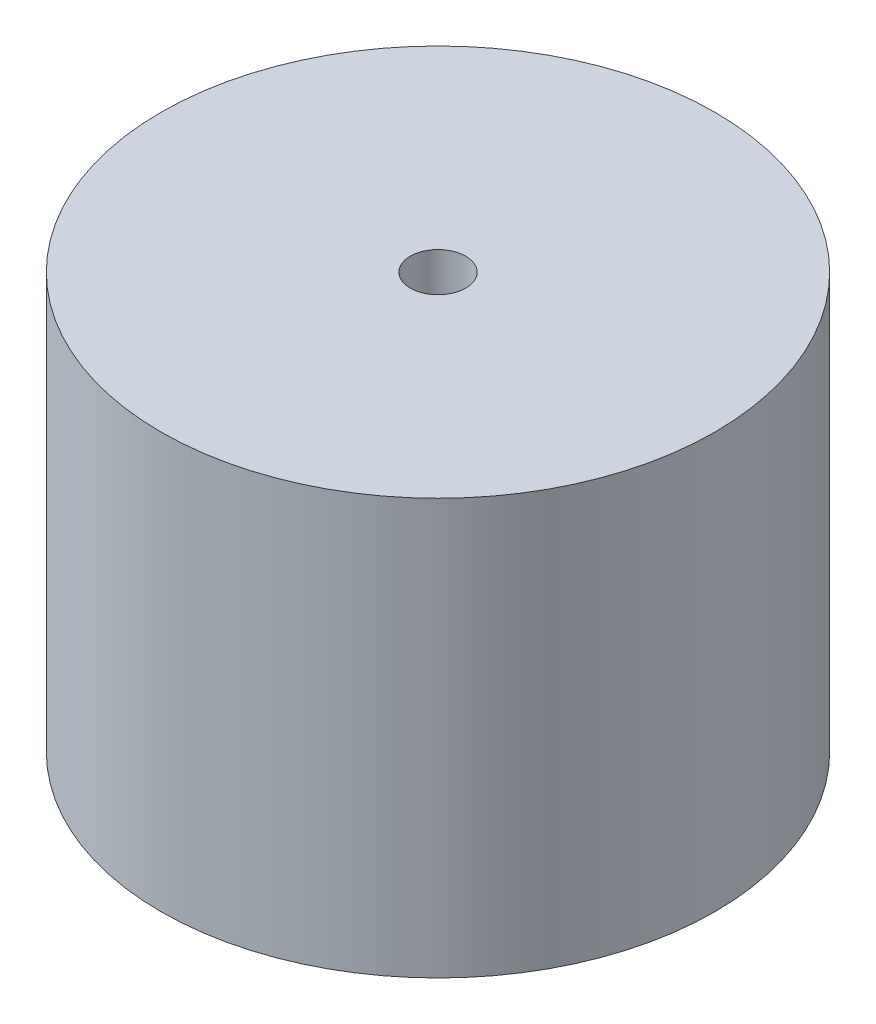
from build123d import *

# Parameters (mm, degrees)
SKETCH_1_R               = 5
EXTRUDE_1_DEPTH          = 7.5
SKETCH_1_5_R             = 2.75
CUT_EXTRUDE_1_DEPTH      = 6.5
SKETCH_1_6_R             = 0.5
CUT_EXTRUDE_2_DEPTH      = 11.307764064
SKETCH_1_7_R             = 0.35
CUT_EXTRUDE_3_DEPTH      = 2
PATTERN_CIRCULAR_1_COUNT = 4


with BuildPart() as part:
    # 草图1 → 凸台-拉伸1 (new body)
    with BuildSketch(Plane(origin=(0, 0, 0), x_dir=(1, 0, 0), z_dir=(0, 1, 0))):
        Circle(SKETCH_1_R)
    extrude(amount=EXTRUDE_1_DEPTH)

    # 草图1<5> → 切除-拉伸1 (cut)
    with BuildSketch(Plane(origin=(0, 0, 0), x_dir=(1, 0, 0), z_dir=(0, 1, 0))):
        Circle(SKETCH_1_5_R)
    extrude(amount=CUT_EXTRUDE_1_DEPTH, mode=Mode.SUBTRACT)

    # 草图1<6> → 切除-拉伸2 (cut, through all)
    with BuildSketch(Plane(origin=(0, 0, 0), x_dir=(1, 0, 0), z_dir=(0, 1, 0))):
        Circle(SKETCH_1_6_R)
    extrude(amount=CUT_EXTRUDE_2_DEPTH, mode=Mode.SUBTRACT)

    # 草图1<7> → 切除-拉伸3 (cut)
    with BuildSketch(Plane(origin=(0, 0, 0), x_dir=(1, 0, 0), z_dir=(0, 1, 0))):
        with Locations((-3.875, 0)):
            Circle(SKETCH_1_7_R)
    cut_extrude_3 = extrude(amount=CUT_EXTRUDE_3_DEPTH, mode=Mode.SUBTRACT)

    # 阵列(圆周)1: 切除-拉伸3 ×4 about axis
    pattern_circular_1_axis = Axis((0, 7.5, 0), (0, -1, 0))
    for i in range(1, PATTERN_CIRCULAR_1_COUNT):
        add(cut_extrude_3.rotate(pattern_circular_1_axis, i * 360 / PATTERN_CIRCULAR_1_COUNT), mode=Mode.SUBTRACT)


solid = part.part
